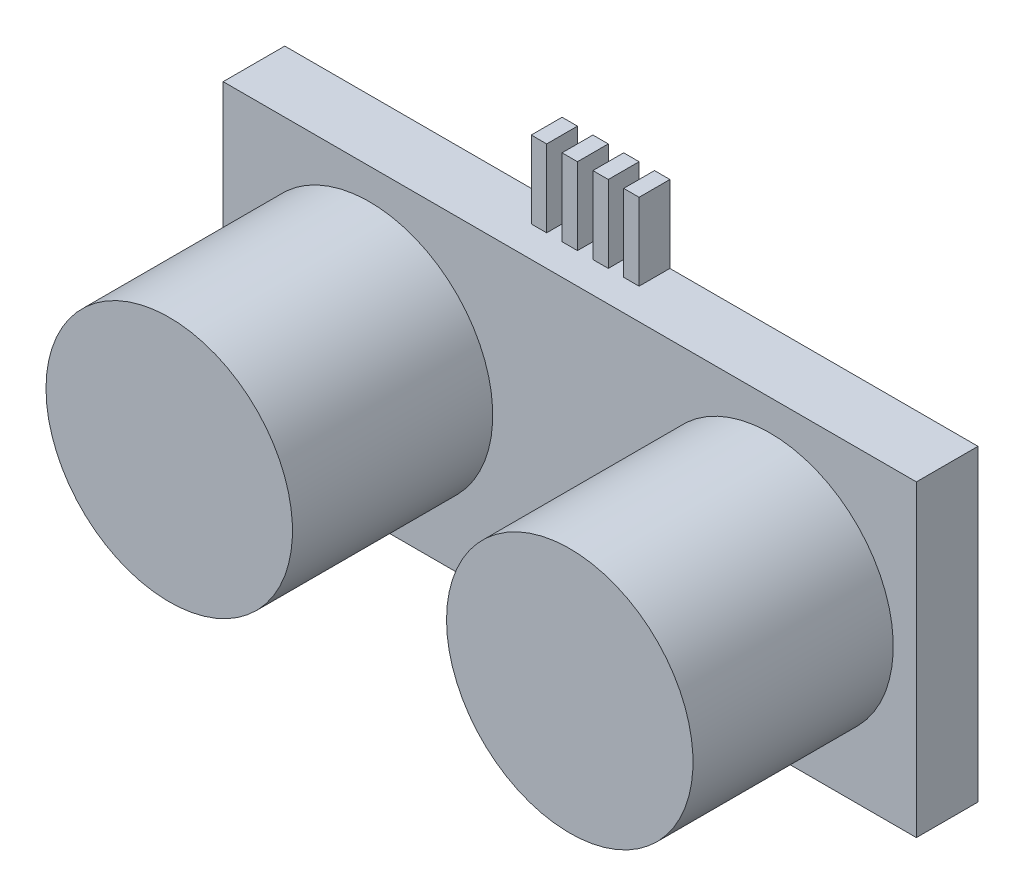
from build123d import *

# Parameters (mm, degrees)
SKETCH1_W           = 45
SKETCH1_H           = 20
BOSS_EXTRUDE1_DEPTH = 4
SKETCH2_R           = 8
BOSS_EXTRUDE2_DEPTH = 13
BOSS_EXTRUDE3_DEPTH = 2


with BuildPart() as part:
    # Sketch1 → Boss-Extrude1 (new body)
    with BuildSketch(Plane.XY):
        Rectangle(SKETCH1_W, SKETCH1_H)
    extrude(amount=BOSS_EXTRUDE1_DEPTH)

    # Sketch2 → Boss-Extrude2 (add)
    with BuildSketch(Plane.XY.offset(4)):
        with Locations(Location((-13, 0, 0), (0, 0, 180))):
            Circle(SKETCH2_R)
        with Locations(Location((13, 0, 0), (0, 0, 180))):
            Circle(SKETCH2_R)
    extrude(amount=BOSS_EXTRUDE2_DEPTH)

    # Sketch4 → Boss-Extrude3 (add)
    with BuildSketch(Plane(origin=(0, 0, 0), x_dir=(-1, 0, 0), z_dir=(0, 0, -1))):
        Polygon((2, 15), (1.5, 15), (1.5, 10), (2.5, 10), (2.5, 15), align=None)
        Polygon((0, 15), (-0.5, 15), (-0.5, 10), (0.5, 10), (0.5, 15), align=None)
        Polygon((4, 15), (3.5, 15), (3.5, 10), (4.5, 10), (4.5, 15), align=None)
        Polygon((-2, 15), (-2.5, 15), (-2.5, 10), (-1.5, 10), (-1.5, 15), align=None)
    extrude(amount=-BOSS_EXTRUDE3_DEPTH)


solid = part.part
